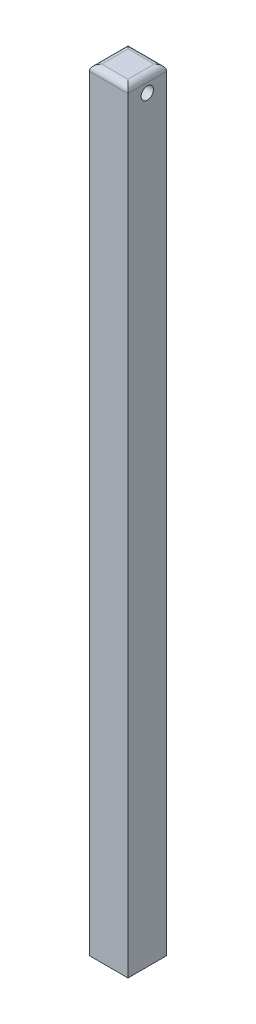
from build123d import *

# Parameters (mm, degrees)
CUT_EXTRUDE1_DEPTH      = 258.20505856
CUT_EXTRUDE1_DEPTH_BACK = 258.20505856
SKETCH2_R               = 4
FILLET1_R               = 4
SCALE1_SCALE            = 5


with BuildPart() as part:
    # Sweep1: sweep along a path in Sketch1
    with BuildLine(Plane.XY) as sweep1_path:
        Line((0, 244.318181818), (0, -255.681818182))
    # 3DSketch1 → Sweep1 (sweep)
    with BuildSketch(Plane(origin=(12.5, -255.681818182, -12.5), x_dir=(-0.7071067811865476, 0, 0.7071067811865476), z_dir=(0, 1, 0))):
        Polygon((0, 0), (17.67766953, 17.67766953), (35.355339059, 0), (17.67766953, -17.67766953), align=None)
    sweep(path=sweep1_path.line)

    # Sketch2 → Cut-Extrude1 (cut, two sides: drawn at the far end of the back side and taken through both)
    with BuildSketch(Plane(origin=(12.5, 0, 0), x_dir=(0, 0, -1), z_dir=(1, 0, 0)).offset(-CUT_EXTRUDE1_DEPTH_BACK)):
        with Locations((0, 234.318181818)):
            Circle(SKETCH2_R)
    extrude(amount=CUT_EXTRUDE1_DEPTH + CUT_EXTRUDE1_DEPTH_BACK, mode=Mode.SUBTRACT)

    # Fillet1
    fillet1_edges = [part.edges().sort_by_distance(p)[0] for p in [
        (-12.5, 244.318181818, 0),
        (0, 244.318181818, -12.5),
        (12.5, 244.318181818, 0),
        (0, 244.318181818, 12.5),
    ]]
    fillet(fillet1_edges, radius=FILLET1_R)


with BuildPart() as part_1:
    # Scale1: scaled about (0, 0, 0)
    add(part.part.scale(SCALE1_SCALE))


solid = part_1.part
